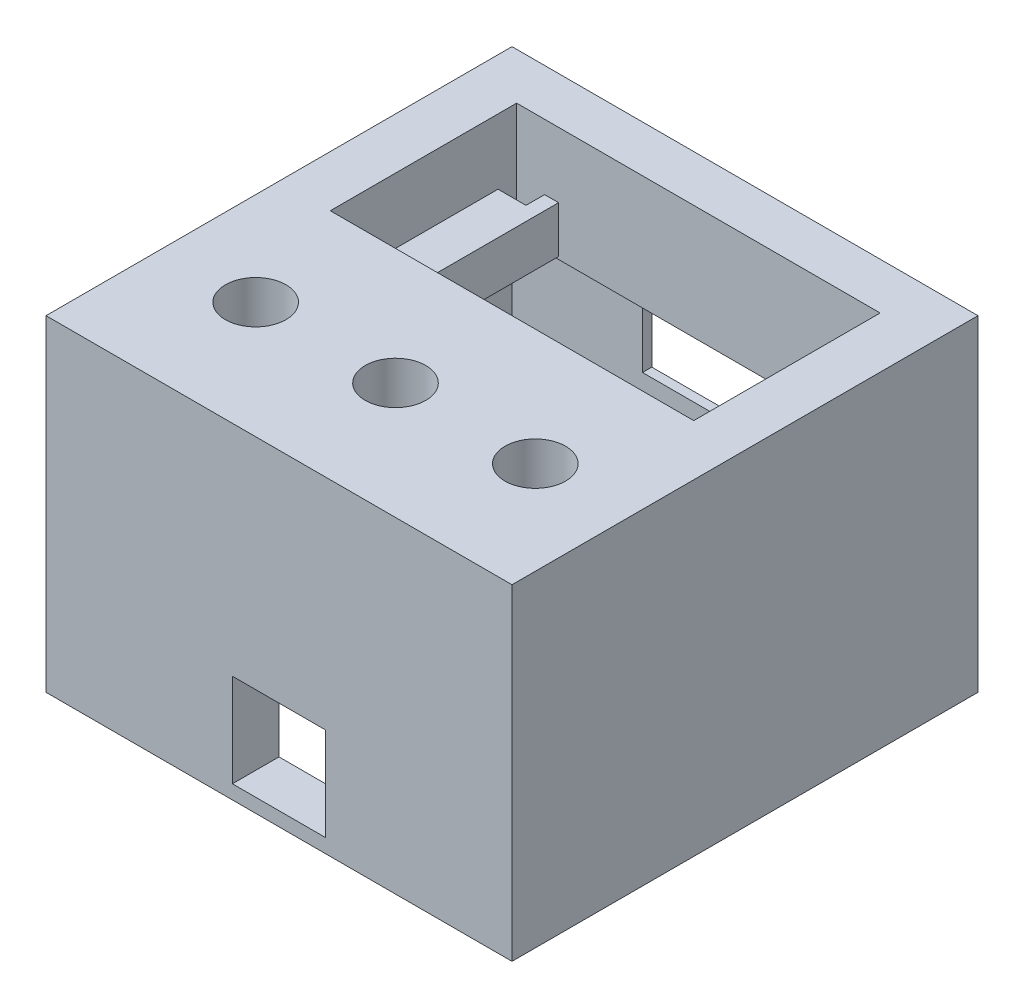
from build123d import *

# Parameters (mm, degrees)
BOSS_EXTRUDE1_DEPTH = 40
SKETCH4_R           = 3.25
CUT_EXTRUDE1_DEPTH  = 6
SKETCH5_W           = 8
SKETCH5_H           = 13
CUT_EXTRUDE2_DEPTH  = 34
SKETCH6_W           = 8
SKETCH6_H           = 13
CUT_EXTRUDE3_DEPTH  = 24
CUT_EXTRUDE4_DEPTH  = 7
SKETCH8_W           = 30
SKETCH8_H           = 20
CUT_EXTRUDE5_DEPTH  = 33
SKETCH8_3_W         = 5
SKETCH8_3_H         = 20
CUT_EXTRUDE6_DEPTH  = 24
CUT_EXTRUDE7_DEPTH  = 24
SKETCH7_W           = 3
SKETCH7_H           = 2
CUT_EXTRUDE8_DEPTH  = 10
CUT_EXTRUDE9_DEPTH  = 10
SKETCH12_W          = 50
SKETCH12_H          = 50
CUT_EXTRUDE10_DEPTH = 5
SKETCH16_W          = 5
SKETCH16_H          = 20
CUT_EXTRUDE11_DEPTH = 4
CUT_EXTRUDE12_DEPTH = 5
CUT_EXTRUDE13_DEPTH = 4
CUT_EXTRUDE14_DEPTH = 4
SKETCH11_W          = 10
SKETCH11_H          = 10
CUT_EXTRUDE15_DEPTH = 5
SKETCH20_R          = 6.5
CUT_EXTRUDE16_DEPTH = 29


with BuildPart() as part:
    # Sketch2 → Boss-Extrude1 (new body)
    with BuildSketch(Plane(origin=(0, 0, 0), x_dir=(1, 0, 0), z_dir=(0, 1, 0))):
        Polygon((0, 25), (-25, 25), (-25, -25), (25, -25), (25, 25), align=None)
    extrude(amount=-BOSS_EXTRUDE1_DEPTH)

    # Sketch4 → Cut-Extrude1 (cut)
    with BuildSketch(Plane(origin=(0, 0, 0), x_dir=(1, 0, 0), z_dir=(0, 1, 0))):
        with Locations((0, -12.5)):
            Circle(SKETCH4_R)
        with Locations((15, -12.5)):
            Circle(SKETCH4_R)
        with Locations((-15, -12.5)):
            Circle(SKETCH4_R)
    extrude(amount=-CUT_EXTRUDE1_DEPTH, mode=Mode.SUBTRACT)

    # Sketch5 → Cut-Extrude2 (cut)
    with BuildSketch(Plane.XZ.offset(40)):
        with Locations((-15, 12.5)):
            Rectangle(SKETCH5_W, SKETCH5_H)
        with Locations((0, 12.5)):
            Rectangle(SKETCH5_W, SKETCH5_H)
        with Locations((15, 12.5)):
            Rectangle(SKETCH5_W, SKETCH5_H)
    extrude(amount=-CUT_EXTRUDE2_DEPTH, mode=Mode.SUBTRACT)

    # Sketch6 → Cut-Extrude3 (cut)
    with BuildSketch(Plane.XZ.offset(40)):
        Polygon((-20, 20), (-20, 3), (0, 3), (20, 3), (20, 20), align=None)
        with Locations((-15, 12.5)):
            Rectangle(SKETCH6_W, SKETCH6_H, mode=Mode.SUBTRACT)
        Polygon((4, 6), (0, 6), (-4, 6), (-4, 19), (4, 19), align=None, mode=Mode.SUBTRACT)
        with Locations((15, 12.5)):
            Rectangle(SKETCH6_W, SKETCH6_H, mode=Mode.SUBTRACT)
    extrude(amount=-CUT_EXTRUDE3_DEPTH, mode=Mode.SUBTRACT)

    # Sketch3 → Cut-Extrude4 (cut)
    with BuildSketch(Plane(origin=(0, 0, 0), x_dir=(1, 0, 0), z_dir=(0, 1, 0))):
        Polygon((19.5, 20), (0, 20), (-19.5, 20), (-19.5, 0), (19.5, 0), align=None)
    extrude(amount=-CUT_EXTRUDE4_DEPTH, mode=Mode.SUBTRACT)

    # Sketch8 → Cut-Extrude5 (cut)
    with BuildSketch(Plane.XZ.offset(40)):
        with Locations((0, -10)):
            Rectangle(SKETCH8_W, SKETCH8_H)
    extrude(amount=-CUT_EXTRUDE5_DEPTH, mode=Mode.SUBTRACT)

    # Sketch8<3> → Cut-Extrude6 (cut)
    with BuildSketch(Plane.XZ.offset(40)):
        with Locations((-17.5, -10)):
            Rectangle(SKETCH8_3_W, SKETCH8_3_H)
        with Locations((17.5, -10)):
            Rectangle(SKETCH8_3_W, SKETCH8_3_H)
    extrude(amount=-CUT_EXTRUDE6_DEPTH, mode=Mode.SUBTRACT)

    # Sketch8<4> → Cut-Extrude7 (cut)
    with BuildSketch(Plane.XZ.offset(40)):
        Polygon((20, 3), (-20, 3), (-20, 0), (-15, 0), (0, 0), (15, 0), (20, 0), align=None)
    extrude(amount=-CUT_EXTRUDE7_DEPTH, mode=Mode.SUBTRACT)

    # Sketch7 → Cut-Extrude8 (cut)
    with BuildSketch(Plane(origin=(0, -7, 0), x_dir=(1, 0, 0), z_dir=(0, 1, 0))):
        with Locations((-18, 19)):
            Rectangle(SKETCH7_W, SKETCH7_H)
        with Locations((-18, 1)):
            Rectangle(SKETCH7_W, SKETCH7_H)
        with Locations((18, 1)):
            Rectangle(SKETCH7_W, SKETCH7_H)
        with Locations((18, 19)):
            Rectangle(SKETCH7_W, SKETCH7_H)
    extrude(amount=-CUT_EXTRUDE8_DEPTH, mode=Mode.SUBTRACT)

    # Sketch9 → Cut-Extrude9 (cut)
    with BuildSketch(Plane.XZ.offset(40)):
        Polygon((-24, 24), (-24, 22.5), (-24, 21), (-21, 21), (-21, 24), align=None)
        Polygon((-21, -24), (-21, -22.5), (-21, -21), (-24, -21), (-24, -24), align=None)
        Polygon((21, -21), (21, -22.5), (21, -24), (24, -24), (24, -21), align=None)
        Polygon((24, 21), (24, 22.5), (24, 24), (21, 24), (21, 21), align=None)
    extrude(amount=-CUT_EXTRUDE9_DEPTH, mode=Mode.SUBTRACT)

    # Sketch12 → Cut-Extrude10 (cut)
    with BuildSketch(Plane.XZ.offset(40)):
        Rectangle(SKETCH12_W, SKETCH12_H)
    extrude(amount=-CUT_EXTRUDE10_DEPTH, mode=Mode.SUBTRACT)

    # Sketch16 → Cut-Extrude11 (cut)
    with BuildSketch(Plane.XZ.offset(16)):
        with Locations((17.5, -10)):
            Rectangle(SKETCH16_W, SKETCH16_H)
        with Locations((-17.5, -10)):
            Rectangle(SKETCH16_W, SKETCH16_H)
    extrude(amount=-CUT_EXTRUDE11_DEPTH, mode=Mode.SUBTRACT)

    # Sketch13 → Cut-Extrude12 (cut)
    with BuildSketch(Plane(origin=(0, 0, -25), x_dir=(-1, 0, 0), z_dir=(0, 0, -1))):
        Polygon((0, -16.279858657), (10, -16.279858657), (10, -22.279858657), (-10, -22.279858657), (-10, -16.279858657), align=None)
    extrude(amount=-CUT_EXTRUDE12_DEPTH, mode=Mode.SUBTRACT)

    # Sketch14 → Cut-Extrude13 (cut)
    with BuildSketch(Plane.XY.offset(-20)):
        Polygon((10, -19.279858657), (10, -12.279858657), (-20, -12.279858657), (-20, -36.279858657), (10, -36.279858657), align=None)
    extrude(amount=-CUT_EXTRUDE13_DEPTH, mode=Mode.SUBTRACT)

    # Sketch18 → Cut-Extrude14 (cut)
    with BuildSketch(Plane(origin=(-20, 0, 0), x_dir=(0, 0, -1), z_dir=(1, 0, 0))):
        Polygon((4, -29), (24, -29), (24, -12.279858657), (20, -12.279858657), (4, -12.279858657), align=None)
    extrude(amount=-CUT_EXTRUDE14_DEPTH, mode=Mode.SUBTRACT)

    # Sketch11 → Cut-Extrude15 (cut)
    with BuildSketch(Plane.XY.offset(25)):
        with Locations((0, -28.5)):
            Rectangle(SKETCH11_W, SKETCH11_H)
    extrude(amount=-CUT_EXTRUDE15_DEPTH, mode=Mode.SUBTRACT)

    # Sketch20 → Cut-Extrude16 (cut)
    with BuildSketch(Plane.XZ.offset(35)):
        with Locations((15, 12.5)):
            Circle(SKETCH20_R)
        with Locations((0, 12.5)):
            Circle(SKETCH20_R)
        with Locations((-15, 12.5)):
            Circle(SKETCH20_R)
    extrude(amount=-CUT_EXTRUDE16_DEPTH, mode=Mode.SUBTRACT)


solid = part.part
